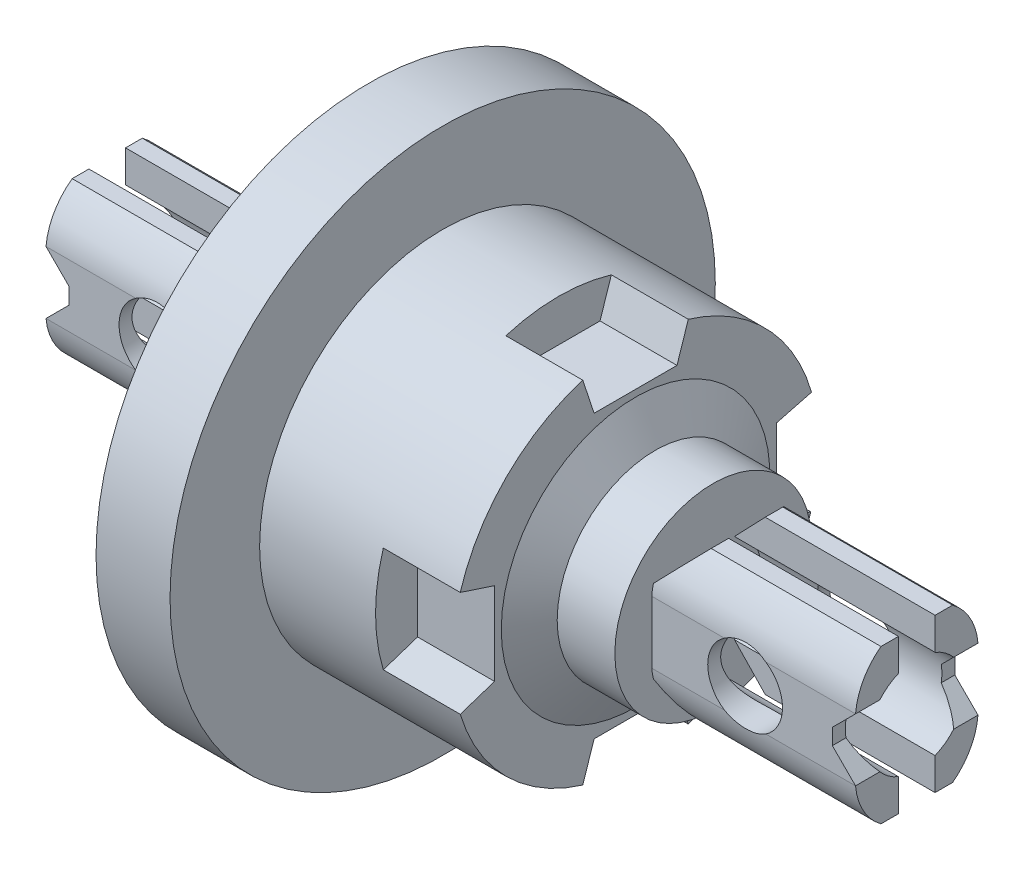
from build123d import *

# Parameters (mm, degrees)
CUT_EXTRUDE1_START  = -6.2738
CUT_EXTRUDE1_DEPTH  = 6.2738
SKETCH4_R           = 3.048
BOSS_EXTRUDE1_DEPTH = 4.9911
CUT_EXTRUDE2_REACH  = 75.092
CUT_EXTRUDE5_REACH  = 75.092


with BuildPart() as part:
    # Sketch1 → Revolve1 (revolve)
    with BuildSketch(Plane.XY, mode=Mode.PRIVATE) as revolve1_sk:
        Polygon((32.766, 0), (32.766, 8.001), (28.067, 8.001), (26.4541, 10.9474), (26.4541, 14.9225), (10.7315, 14.9225), (10.7315, 22.225), (4.699, 22.225), (4.699, 8.001), (0, 8.001), (0, 0), align=None)
    revolve(revolve1_sk.sketch.rotate(Axis((-42.24528, 0, 0), (1, 0, 0)), 90), axis=Axis((-42.24528, 0, 0), (1, 0, 0)))

    # Sketch2 → Cut-Extrude1 (cut)
    with BuildSketch(Plane(origin=(26.4541, 0, 0), x_dir=(0, 0, -1), z_dir=(1, 0, 0)).offset(CUT_EXTRUDE1_START)):
        with BuildLine():
            Line((-11.4935, -3.3782), (-11.4935, 3.3782))
            Line((-11.4935, 3.3782), (-14.289508899, 4.300109496))
            ThreePointArc((-14.289508899, 4.300109496), (-14.9225, 0), (-14.289508899, -4.300109496))
            Line((-14.289508899, -4.300109496), (-11.4935, -3.3782))
        make_face()
        with BuildLine():
            Line((-3.3782, -11.4935), (3.3782, -11.4935))
            Line((3.3782, -11.4935), (4.300109496, -14.289508899))
            ThreePointArc((4.300109496, -14.289508899), (0, -14.9225), (-4.300109496, -14.289508899))
            Line((-4.300109496, -14.289508899), (-3.3782, -11.4935))
        make_face()
        with BuildLine():
            Line((11.4935, 3.3782), (11.4935, -3.3782))
            Line((11.4935, -3.3782), (14.289508899, -4.300109496))
            ThreePointArc((14.289508899, -4.300109496), (14.922190965, -0.096036735), (14.34367249, 4.115831111))
            Line((14.34367249, 4.115831111), (11.4935, 3.3782))
        make_face()
        with BuildLine():
            Line((3.3782, 11.4935), (-3.3782, 11.4935))
            Line((-3.3782, 11.4935), (-4.300109496, 14.289508899))
            ThreePointArc((-4.300109496, 14.289508899), (0, 14.9225), (4.300109496, 14.289508899))
            Line((4.300109496, 14.289508899), (3.3782, 11.4935))
        make_face()
    extrude(amount=CUT_EXTRUDE1_DEPTH, mode=Mode.SUBTRACT)

    # Sketch4 → Boss-Extrude1 (add, symmetric)
    # profile 1 of 2: a face of its own
    with BuildSketch(Plane.XY):
        Polygon((32.766, -3.374898487), (35.5346, -6.2611), (49.3776, -6.2611), (49.3776, -2.54), (47.487656847, -0.650056847), (47.487656847, 0.650056847), (49.3776, 2.54), (49.3776, 6.2611), (35.5346, 6.2611), (32.766, 3.374898487), align=None)
        with Locations(Location((40.375656847, 0, 0), (0, 0, 180))):
            Circle(SKETCH4_R, mode=Mode.SUBTRACT)
    # profile 2 of 2: a face of its own
    with BuildSketch(Plane.XY):
        Polygon((-16.6116, -6.2611), (-2.7686, -6.2611), (0, -3.374898487), (0, 3.374898487), (-2.7686, 6.2611), (-16.6116, 6.2611), (-16.6116, 2.54), (-14.721656847, 0.650056847), (-14.721656847, -0.650056847), (-16.6116, -2.54), align=None)
        with Locations(Location((-7.609656847, 0, 0), (0, 0, 180))):
            Circle(SKETCH4_R, mode=Mode.SUBTRACT)
    extrude(amount=BOSS_EXTRUDE1_DEPTH, both=True)

    # Cut-Extrude2: up to this face of the body (flat: up to its plane)
    cut_extrude2_end = Plane(part.part.faces().sort_by_distance((0, 0, -7.774697546))[0])
    # Sketch5 → Cut-Extrude2 (cut, up to the picked face)
    with BuildSketch(Plane.ZY.offset(16.6116), mode=Mode.PRIVATE) as cut_extrude2_sk1:
        with BuildLine():
            Line((1.49225, 3.643234681), (1.49225, 6.2611))
            Line((1.49225, 6.2611), (-1.49225, 6.2611))
            Line((-1.49225, 6.2611), (-1.49225, 3.643234681))
            ThreePointArc((-1.49225, 3.643234681), (-3.937, 0), (-1.49225, -3.643234681))
            Line((-1.49225, -3.643234681), (-1.49225, -6.2611))
            Line((-1.49225, -6.2611), (1.49225, -6.2611))
            Line((1.49225, -6.2611), (1.49225, -3.643234681))
            ThreePointArc((1.49225, -3.643234681), (3.937, 0), (1.49225, 3.643234681))
        make_face()
    cut_extrude2_tool1 = split(extrude(cut_extrude2_sk1.sketch, amount=-CUT_EXTRUDE2_REACH, mode=Mode.PRIVATE), bisect_by=cut_extrude2_end, keep=Keep.BOTH, mode=Mode.PRIVATE)
    # Sketch5 → Cut-Extrude2 (cut, up to the picked face)
    with BuildSketch(Plane.ZY.offset(16.6116), mode=Mode.PRIVATE) as cut_extrude2_sk2:
        with BuildLine():
            Line((4.9911, 2.54), (4.9911, 6.2611))
            Line((4.9911, 6.2611), (2.8575, 6.2611))
            ThreePointArc((2.8575, 6.2611), (4.326988371, 4.631442991), (4.9911, 2.54))
        make_face()
    cut_extrude2_tool2 = split(extrude(cut_extrude2_sk2.sketch, amount=-CUT_EXTRUDE2_REACH, mode=Mode.PRIVATE), bisect_by=cut_extrude2_end, keep=Keep.BOTH, mode=Mode.PRIVATE)
    # Sketch5 → Cut-Extrude2 (cut, up to the picked face)
    with BuildSketch(Plane.ZY.offset(16.6116), mode=Mode.PRIVATE) as cut_extrude2_sk3:
        with BuildLine():
            Line((-4.9911, 2.54), (-4.9911, 6.2611))
            Line((-4.9911, 6.2611), (-2.8575, 6.2611))
            ThreePointArc((-2.8575, 6.2611), (-4.326988371, 4.631442991), (-4.9911, 2.54))
        make_face()
    cut_extrude2_tool3 = split(extrude(cut_extrude2_sk3.sketch, amount=-CUT_EXTRUDE2_REACH, mode=Mode.PRIVATE), bisect_by=cut_extrude2_end, keep=Keep.BOTH, mode=Mode.PRIVATE)
    # Sketch5 → Cut-Extrude2 (cut, up to the picked face)
    with BuildSketch(Plane.ZY.offset(16.6116), mode=Mode.PRIVATE) as cut_extrude2_sk4:
        with BuildLine():
            Line((-4.9911, -2.54), (-4.9911, -6.2611))
            Line((-4.9911, -6.2611), (-2.8575, -6.2611))
            ThreePointArc((-2.8575, -6.2611), (-4.326988371, -4.631442991), (-4.9911, -2.54))
        make_face()
    cut_extrude2_tool4 = split(extrude(cut_extrude2_sk4.sketch, amount=-CUT_EXTRUDE2_REACH, mode=Mode.PRIVATE), bisect_by=cut_extrude2_end, keep=Keep.BOTH, mode=Mode.PRIVATE)
    # Sketch5 → Cut-Extrude2 (cut, up to the picked face)
    with BuildSketch(Plane.ZY.offset(16.6116), mode=Mode.PRIVATE) as cut_extrude2_sk5:
        with BuildLine():
            Line((4.9911, -2.54), (4.9911, -6.2611))
            Line((4.9911, -6.2611), (2.8575, -6.2611))
            ThreePointArc((2.8575, -6.2611), (4.326988371, -4.631442991), (4.9911, -2.54))
        make_face()
    cut_extrude2_tool5 = split(extrude(cut_extrude2_sk5.sketch, amount=-CUT_EXTRUDE2_REACH, mode=Mode.PRIVATE), bisect_by=cut_extrude2_end, keep=Keep.BOTH, mode=Mode.PRIVATE)
    add(cut_extrude2_tool1.solids().sort_by(Axis((-16.6116, 0, 0), (1, 0, 0)))[0], mode=Mode.SUBTRACT)
    add(cut_extrude2_tool2.solids().sort_by(Axis((-16.6116, 5.289433, 4.378672), (1, 0, 0)))[0], mode=Mode.SUBTRACT)
    add(cut_extrude2_tool3.solids().sort_by(Axis((-16.6116, 5.289433, -4.378672), (1, 0, 0)))[0], mode=Mode.SUBTRACT)
    add(cut_extrude2_tool4.solids().sort_by(Axis((-16.6116, -5.289433, -4.378672), (1, 0, 0)))[0], mode=Mode.SUBTRACT)
    add(cut_extrude2_tool5.solids().sort_by(Axis((-16.6116, -5.289433, 4.378672), (1, 0, 0)))[0], mode=Mode.SUBTRACT)

    # Cut-Extrude5: up to this face of the body (flat: up to its plane)
    cut_extrude5_end = Plane(part.part.faces().sort_by_distance((32.766, 0, -7.774697546))[0])
    # Sketch6 → Cut-Extrude5 (cut, up to the picked face)
    with BuildSketch(Plane(origin=(49.3776, 0, 0), x_dir=(0, 0, -1), z_dir=(1, 0, 0)), mode=Mode.PRIVATE) as cut_extrude5_sk1:
        with BuildLine():
            Line((4.9911, -6.2611), (4.9911, -2.54))
            ThreePointArc((4.9911, -2.54), (4.354618631, -4.623018442), (2.919082782, -6.2611))
            Line((2.919082782, -6.2611), (4.9911, -6.2611))
        make_face()
    cut_extrude5_tool1 = split(extrude(cut_extrude5_sk1.sketch, amount=-CUT_EXTRUDE5_REACH, mode=Mode.PRIVATE), bisect_by=cut_extrude5_end, keep=Keep.BOTH, mode=Mode.PRIVATE)
    # Sketch6 → Cut-Extrude5 (cut, up to the picked face)
    with BuildSketch(Plane(origin=(49.3776, 0, 0), x_dir=(0, 0, -1), z_dir=(1, 0, 0)), mode=Mode.PRIVATE) as cut_extrude5_sk2:
        with BuildLine():
            ThreePointArc((-2.919082782, -6.2611), (-4.354618631, -4.623018442), (-4.9911, -2.54))
            Line((-4.9911, -2.54), (-4.9911, -6.2611))
            Line((-4.9911, -6.2611), (-2.919082782, -6.2611))
        make_face()
    cut_extrude5_tool2 = split(extrude(cut_extrude5_sk2.sketch, amount=-CUT_EXTRUDE5_REACH, mode=Mode.PRIVATE), bisect_by=cut_extrude5_end, keep=Keep.BOTH, mode=Mode.PRIVATE)
    # Sketch6 → Cut-Extrude5 (cut, up to the picked face)
    with BuildSketch(Plane(origin=(49.3776, 0, 0), x_dir=(0, 0, -1), z_dir=(1, 0, 0)), mode=Mode.PRIVATE) as cut_extrude5_sk3:
        with BuildLine():
            Line((0, -2.54), (0, 6.2611))
            Line((0, 6.2611), (-1.49225, 6.2611))
            Line((-1.49225, 6.2611), (-1.49225, 3.643234681))
            ThreePointArc((-1.49225, 3.643234681), (-3.8237775, 0.937387129), (-3.008050698, -2.54))
            Line((-3.008050698, -2.54), (0, -2.54))
        make_face()
    cut_extrude5_tool3 = split(extrude(cut_extrude5_sk3.sketch, amount=-CUT_EXTRUDE5_REACH, mode=Mode.PRIVATE), bisect_by=cut_extrude5_end, keep=Keep.BOTH, mode=Mode.PRIVATE)
    # Sketch6 → Cut-Extrude5 (cut, up to the picked face)
    with BuildSketch(Plane(origin=(49.3776, 0, 0), x_dir=(0, 0, -1), z_dir=(1, 0, 0)), mode=Mode.PRIVATE) as cut_extrude5_sk4:
        with BuildLine():
            Line((0, -6.2611), (0, -2.54))
            Line((0, -2.54), (-3.008050698, -2.54))
            ThreePointArc((-3.008050698, -2.54), (-2.316777564, -3.183160492), (-1.49225, -3.643234681))
            Line((-1.49225, -3.643234681), (-1.49225, -6.2611))
            Line((-1.49225, -6.2611), (0, -6.2611))
        make_face()
    cut_extrude5_tool4 = split(extrude(cut_extrude5_sk4.sketch, amount=-CUT_EXTRUDE5_REACH, mode=Mode.PRIVATE), bisect_by=cut_extrude5_end, keep=Keep.BOTH, mode=Mode.PRIVATE)
    # Sketch6 → Cut-Extrude5 (cut, up to the picked face)
    with BuildSketch(Plane(origin=(49.3776, 0, 0), x_dir=(0, 0, -1), z_dir=(1, 0, 0)), mode=Mode.PRIVATE) as cut_extrude5_sk5:
        with BuildLine():
            Line((3.008050698, -2.54), (0, -2.54))
            Line((0, -2.54), (0, -6.2611))
            Line((0, -6.2611), (1.49225, -6.2611))
            Line((1.49225, -6.2611), (1.49225, -3.643234681))
            ThreePointArc((1.49225, -3.643234681), (2.316777564, -3.183160492), (3.008050698, -2.54))
        make_face()
    cut_extrude5_tool5 = split(extrude(cut_extrude5_sk5.sketch, amount=-CUT_EXTRUDE5_REACH, mode=Mode.PRIVATE), bisect_by=cut_extrude5_end, keep=Keep.BOTH, mode=Mode.PRIVATE)
    # Sketch6 → Cut-Extrude5 (cut, up to the picked face)
    with BuildSketch(Plane(origin=(49.3776, 0, 0), x_dir=(0, 0, -1), z_dir=(1, 0, 0)), mode=Mode.PRIVATE) as cut_extrude5_sk6:
        with BuildLine():
            Line((1.49225, 6.2611), (0, 6.2611))
            Line((0, 6.2611), (0, -2.54))
            Line((0, -2.54), (3.008050698, -2.54))
            ThreePointArc((3.008050698, -2.54), (3.8237775, 0.937387129), (1.49225, 3.643234681))
            Line((1.49225, 3.643234681), (1.49225, 6.2611))
        make_face()
    cut_extrude5_tool6 = split(extrude(cut_extrude5_sk6.sketch, amount=-CUT_EXTRUDE5_REACH, mode=Mode.PRIVATE), bisect_by=cut_extrude5_end, keep=Keep.BOTH, mode=Mode.PRIVATE)
    # Sketch6 → Cut-Extrude5 (cut, up to the picked face)
    with BuildSketch(Plane(origin=(49.3776, 0, 0), x_dir=(0, 0, -1), z_dir=(1, 0, 0)), mode=Mode.PRIVATE) as cut_extrude5_sk7:
        with BuildLine():
            ThreePointArc((4.9911, 2.54), (4.354618631, 4.623018442), (2.919082782, 6.2611))
            Line((2.919082782, 6.2611), (4.9911, 6.2611))
            Line((4.9911, 6.2611), (4.9911, 2.54))
        make_face()
    cut_extrude5_tool7 = split(extrude(cut_extrude5_sk7.sketch, amount=-CUT_EXTRUDE5_REACH, mode=Mode.PRIVATE), bisect_by=cut_extrude5_end, keep=Keep.BOTH, mode=Mode.PRIVATE)
    # Sketch6 → Cut-Extrude5 (cut, up to the picked face)
    with BuildSketch(Plane(origin=(49.3776, 0, 0), x_dir=(0, 0, -1), z_dir=(1, 0, 0)), mode=Mode.PRIVATE) as cut_extrude5_sk8:
        with BuildLine():
            ThreePointArc((-4.9911, 2.54), (-4.354618631, 4.623018442), (-2.919082782, 6.2611))
            Line((-2.919082782, 6.2611), (-4.9911, 6.2611))
            Line((-4.9911, 6.2611), (-4.9911, 2.54))
        make_face()
    cut_extrude5_tool8 = split(extrude(cut_extrude5_sk8.sketch, amount=-CUT_EXTRUDE5_REACH, mode=Mode.PRIVATE), bisect_by=cut_extrude5_end, keep=Keep.BOTH, mode=Mode.PRIVATE)
    add(cut_extrude5_tool1.solids().sort_by(Axis((49.3776, -5.294073, -4.395637), (-1, 0, 0)))[0], mode=Mode.SUBTRACT)
    add(cut_extrude5_tool2.solids().sort_by(Axis((49.3776, -5.294073, 4.395637), (-1, 0, 0)))[0], mode=Mode.SUBTRACT)
    add(cut_extrude5_tool3.solids().sort_by(Axis((49.3776, 1.090663, 1.599173), (-1, 0, 0)))[0], mode=Mode.SUBTRACT)
    add(cut_extrude5_tool4.solids().sort_by(Axis((49.3776, -4.18178, 0.939604), (-1, 0, 0)))[0], mode=Mode.SUBTRACT)
    add(cut_extrude5_tool5.solids().sort_by(Axis((49.3776, -4.18178, -0.939604), (-1, 0, 0)))[0], mode=Mode.SUBTRACT)
    add(cut_extrude5_tool6.solids().sort_by(Axis((49.3776, 1.090663, -1.599173), (-1, 0, 0)))[0], mode=Mode.SUBTRACT)
    add(cut_extrude5_tool7.solids().sort_by(Axis((49.3776, 5.294073, -4.395637), (-1, 0, 0)))[0], mode=Mode.SUBTRACT)
    add(cut_extrude5_tool8.solids().sort_by(Axis((49.3776, 5.294073, 4.395637), (-1, 0, 0)))[0], mode=Mode.SUBTRACT)


solid = part.part
